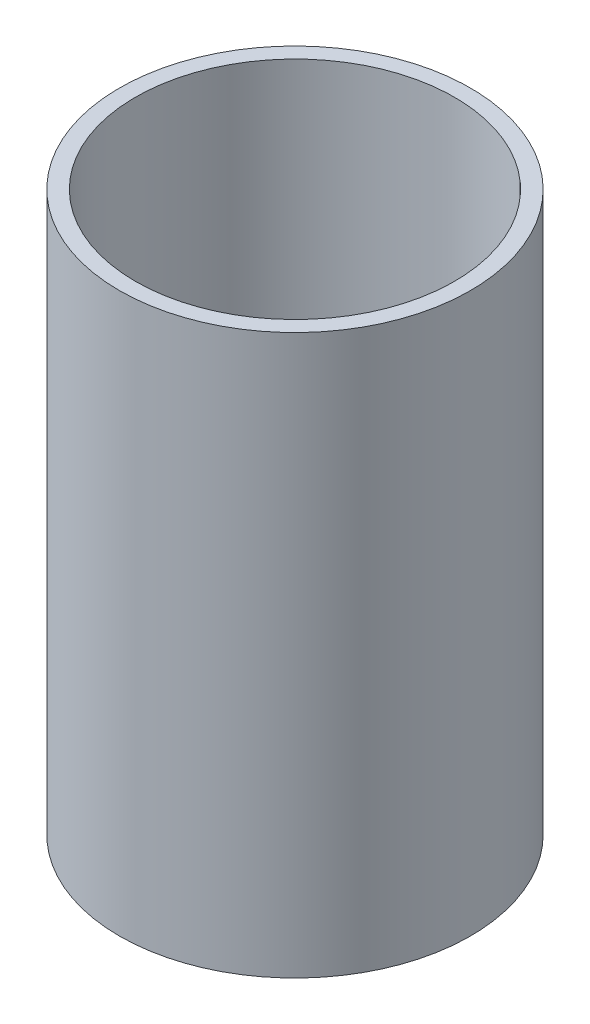
from build123d import *

# Parameters (mm, degrees)
SKETCH1_R           = 69.85
SKETCH1_R_2         = 63.5
BOSS_EXTRUDE1_DEPTH = 222.501157176


with BuildPart() as part:
    # Sketch1 → Boss-Extrude1 (new body)
    with BuildSketch(Plane(origin=(0, 0, 0), x_dir=(1, 0, 0), z_dir=(0, 1, 0))):
        with Locations(Location((0, 0, 0), (0, 0, 270))):
            Circle(SKETCH1_R)
        with Locations(Location((0, 0, 0), (0, 0, 270))):
            Circle(SKETCH1_R_2, mode=Mode.SUBTRACT)
    extrude(amount=BOSS_EXTRUDE1_DEPTH)


solid = part.part
